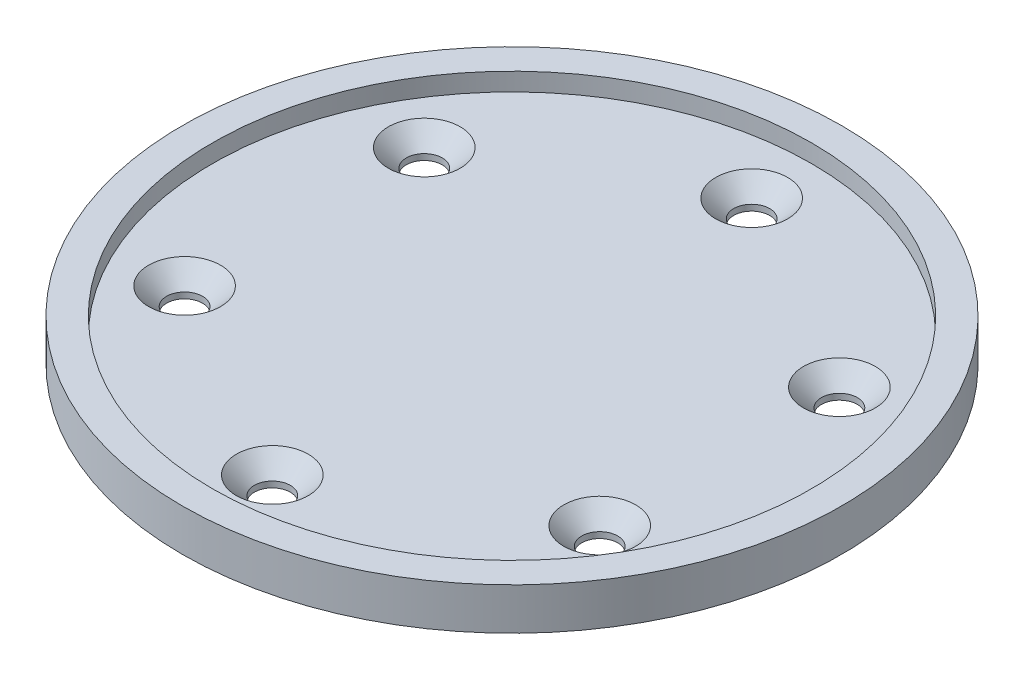
from build123d import *

# Parameters (mm, degrees)
SKETCH2_R          = 3
CUT_EXTRUDE1_DEPTH = 78.884529914
CHAMFER1_SIZE      = 3


with BuildPart() as part:
    # Sketch1 → Revolve1 (revolve)
    with BuildSketch(Plane.XY, mode=Mode.PRIVATE) as revolve1_sk:
        Polygon((50, 3.478641915), (50, 6.478641915), (55, 6.478641915), (55, -0.521358085), (0, -0.521358085), (0, 3.478641915), align=None)
    revolve(revolve1_sk.sketch.rotate(Axis((0, 0, 0), (0, 1, 0)), 90), axis=Axis((0, 0, 0), (0, 1, 0)))

    # Sketch2 → Cut-Extrude1 (cut, through all)
    with BuildSketch(Plane(origin=(0, 3.478641915, 0), x_dir=(1, 0, 0), z_dir=(0, 1, 0))):
        with Locations(Location((0, 40, 0), (0, 0, 270))):
            Circle(SKETCH2_R)
        with Locations(Location((34.641016151, 20, 0), (0, 0, 270))):
            Circle(SKETCH2_R)
        with Locations(Location((34.641016151, -20, 0), (0, 0, 270))):
            Circle(SKETCH2_R)
        with Locations(Location((0, -40, 0), (0, 0, 270))):
            Circle(SKETCH2_R)
        with Locations(Location((-34.641016151, -20, 0), (0, 0, 270))):
            Circle(SKETCH2_R)
        with Locations(Location((-34.641016151, 20, 0), (0, 0, 270))):
            Circle(SKETCH2_R)
    extrude(amount=-CUT_EXTRUDE1_DEPTH, mode=Mode.SUBTRACT)

    # Chamfer1
    chamfer1_edges = [part.edges().sort_by_distance(p)[0] for p in [
        (0, 3.478641915, -43),
        (-34.641016151, 3.478641915, -23),
        (-34.641016151, 3.478641915, 17),
        (0, 3.478641915, 37),
        (34.641016151, 3.478641915, 17),
        (34.641016151, 3.478641915, -23),
    ]]
    chamfer(chamfer1_edges, length=CHAMFER1_SIZE)


solid = part.part
